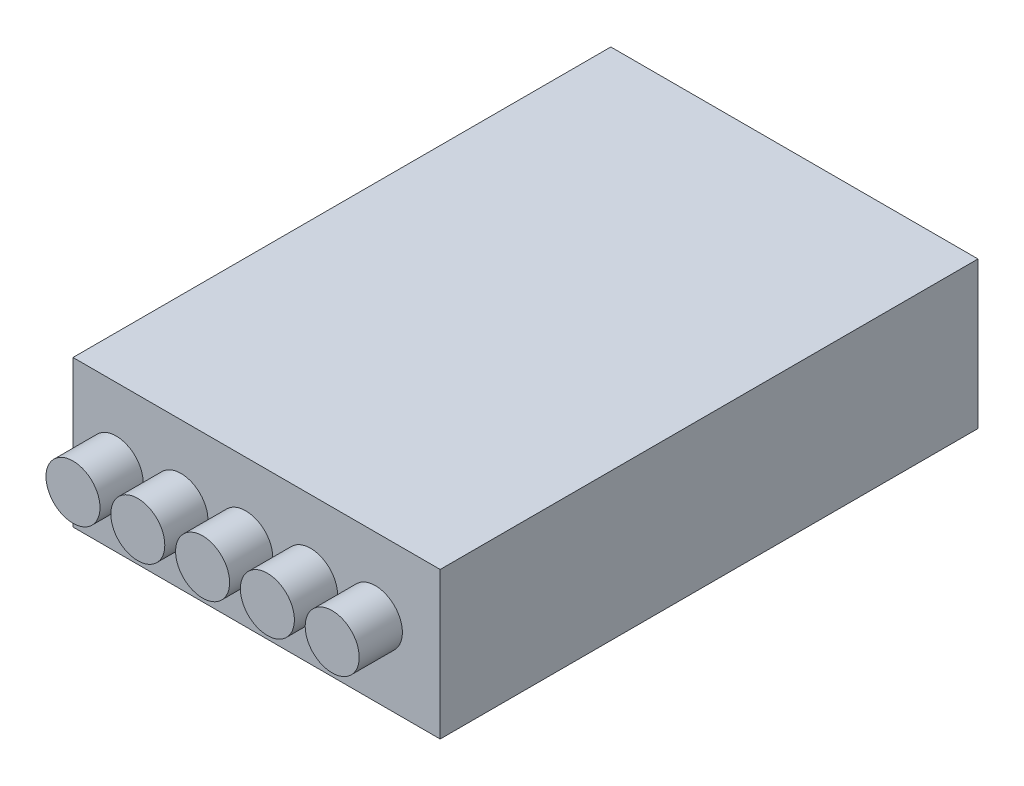
from build123d import *

# Parameters (mm, degrees)
SKETCH1_W           = 170
SKETCH1_H           = 249
BOSS_EXTRUDE1_DEPTH = 68
SKETCH2_R           = 12.5
BOSS_EXTRUDE2_DEPTH = 20


with BuildPart() as part:
    # Sketch1 → Boss-Extrude1 (new body)
    with BuildSketch(Plane(origin=(0, 0, 0), x_dir=(1, 0, 0), z_dir=(0, 1, 0))):
        Rectangle(SKETCH1_W, SKETCH1_H)
    extrude(amount=BOSS_EXTRUDE1_DEPTH)

    # Sketch2 → Boss-Extrude2 (add)
    with BuildSketch(Plane.XY.offset(124.5)):
        with Locations(Location((-65, 34, 0), (0, 0, 180))):
            Circle(SKETCH2_R)
        with Locations(Location((-35, 34, 0), (0, 0, 180))):
            Circle(SKETCH2_R)
        with Locations((-5, 34)):
            Circle(SKETCH2_R)
        with Locations(Location((25, 34, 0), (0, 0, 180))):
            Circle(SKETCH2_R)
        with Locations(Location((55, 34, 0), (0, 0, 180))):
            Circle(SKETCH2_R)
    extrude(amount=BOSS_EXTRUDE2_DEPTH)


solid = part.part
